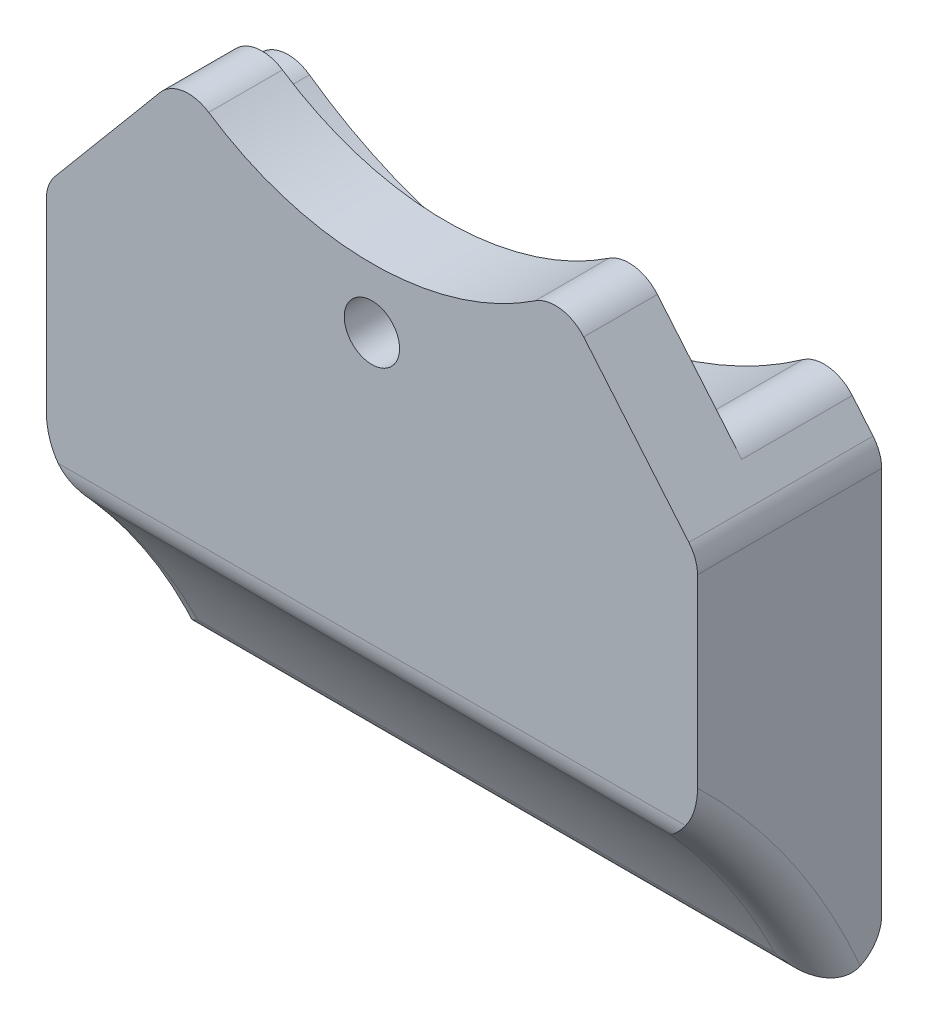
from build123d import *

# Parameters (mm, degrees)
EXTRUDE_1_DEPTH     = 4
EXTRUDE_START       = -10
EXTRUDE_2_DEPTH     = 10
EXTRUDE_3_DEPTH     = 10
CUT_EXTRUDE_1_DEPTH = 80.60065996608486
FILLET_1_R          = 2


with BuildPart() as part:
    # 草图1 → 凸台-拉伸1 (new body)
    with BuildSketch(Plane.XY):
        with BuildLine():
            ThreePointArc((10.284601754984639, -12.256711089903641), (5.472322293210865, -15.035081932574474), (3.3812e-13, -16))
            Line((0, -16), (0, -17.75))
            ThreePointArc((-1.91e-15, -17.75), (1.0606601717798214, -18.189339828220177), (1.5000000000000009, -19.25))
            ThreePointArc((1.5000000000000009, -19.25), (1.0606601717798207, -20.310660171779823), (-2.94e-15, -20.75))
            Line((0, -20.75), (0, -23.100000000000005))
            ThreePointArc((-4.24e-15, -23.100000000000005), (7.900665310822955, -21.706899540154488), (14.848393783759075, -17.695626636048384))
            Line((14.848393783759088, -17.695626636048377), (10.28460175498465, -12.256711089903638))
        make_face()
        with BuildLine():
            Line((0, -17.75), (0, -16))
            ThreePointArc((3.3812e-13, -16), (-5.472322293210549, -15.035081932574588), (-10.284601754984644, -12.256711089903638))
            Line((-10.284601754984646, -12.25671108990364), (-14.848393783759084, -17.69562663604838))
            ThreePointArc((-14.848393783759082, -17.69562663604838), (-7.900665310822965, -21.706899540154485), (-4.24e-15, -23.100000000000005))
            Line((0, -23.100000000000005), (0, -20.75))
            ThreePointArc((-2.94e-15, -20.75), (-1.5000000000000009, -19.25), (-2.24e-15, -17.75))
        make_face()
    extrude(amount=EXTRUDE_1_DEPTH)

    # 草图3 → 凸台-拉伸2 (add)
    with BuildSketch(Plane.XY.offset(4).offset(EXTRUDE_START)):
        with BuildLine():
            ThreePointArc((14.848393783759091, -17.695626636048377), (3.55e-15, -23.100000000000012), (-14.848393783759086, -17.69562663604838))
            Line((-14.848393783759084, -17.69562663604838), (-17.676659266379858, -21.066222185771874))
            ThreePointArc((-17.676659266379858, -21.066222185771878), (-5.05e-15, -27.5), (17.676659266379847, -21.066222185771885))
            Line((17.67665926637986, -21.066222185771874), (14.84839378375909, -17.695626636048377))
        make_face()
    extrude(amount=EXTRUDE_2_DEPTH)

    # 草图4 → 凸台-拉伸3 (add)
    with BuildSketch(Plane.XY.offset(4).offset(EXTRUDE_START)):
        with BuildLine():
            Line((-17.67665926637985, -71.06622218577188), (17.67665926637986, -71.06622218577188))
            Line((17.67665926637986, -71.06622218577188), (17.67665926637986, -21.066222185771874))
            ThreePointArc((17.67665926637986, -21.066222185771874), (1.68e-15, -27.5), (-17.676659266379858, -21.066222185771878))
            Line((-17.676659266379858, -21.066222185771878), (-17.67665926637985, -71.06622218577188))
        make_face()
    extrude(amount=EXTRUDE_3_DEPTH)

    # 草图7 → 切除-拉伸1 (cut, through all)
    with BuildSketch(Plane(origin=(17.67665926637986, 0, 0), x_dir=(0, 0, -1), z_dir=(1, 0, 0))):
        with BuildLine():
            ThreePointArc((6, -57.06223919512314), (2.8499690271271234, -45.04655535209204), (-3.9999999999999893, -34.68425456157568))
            Line((-4, -34.68425456157568), (-4, -71.06622218577188))
            Line((-4, -71.06622218577188), (6, -71.06622218577188))
            Line((6, -71.06622218577188), (6, -57.06223919512314))
        make_face()
    extrude(amount=-CUT_EXTRUDE_1_DEPTH, mode=Mode.SUBTRACT)

    # 圆角1
    fillet_1_edges = [part.edges().sort_by_distance(p)[0] for p in [
        (10.284601754984646, -12.25671108990364, 2),
        (-10.284601754984646, -12.256711089903636, 2),
        (-14.848393783759086, -17.69562663604838, -3),
        (-17.676659266379858, -21.066222185771878, -1),
        (14.848393783759091, -17.69562663604838, -3),
        (17.676659266379858, -21.066222185771885, -1),
        (17.67665926637986, -45.04655535209205, -2.8499690271271234),
        (3.55e-15, -34.68425456157568, 3.999999999999993),
        (3.55e-15, -57.06223919512314, -6),
        (-17.676659266379854, -45.04655535209205, -2.8499690271271234),
    ]]
    fillet(fillet_1_edges, radius=FILLET_1_R)


solid = part.part
